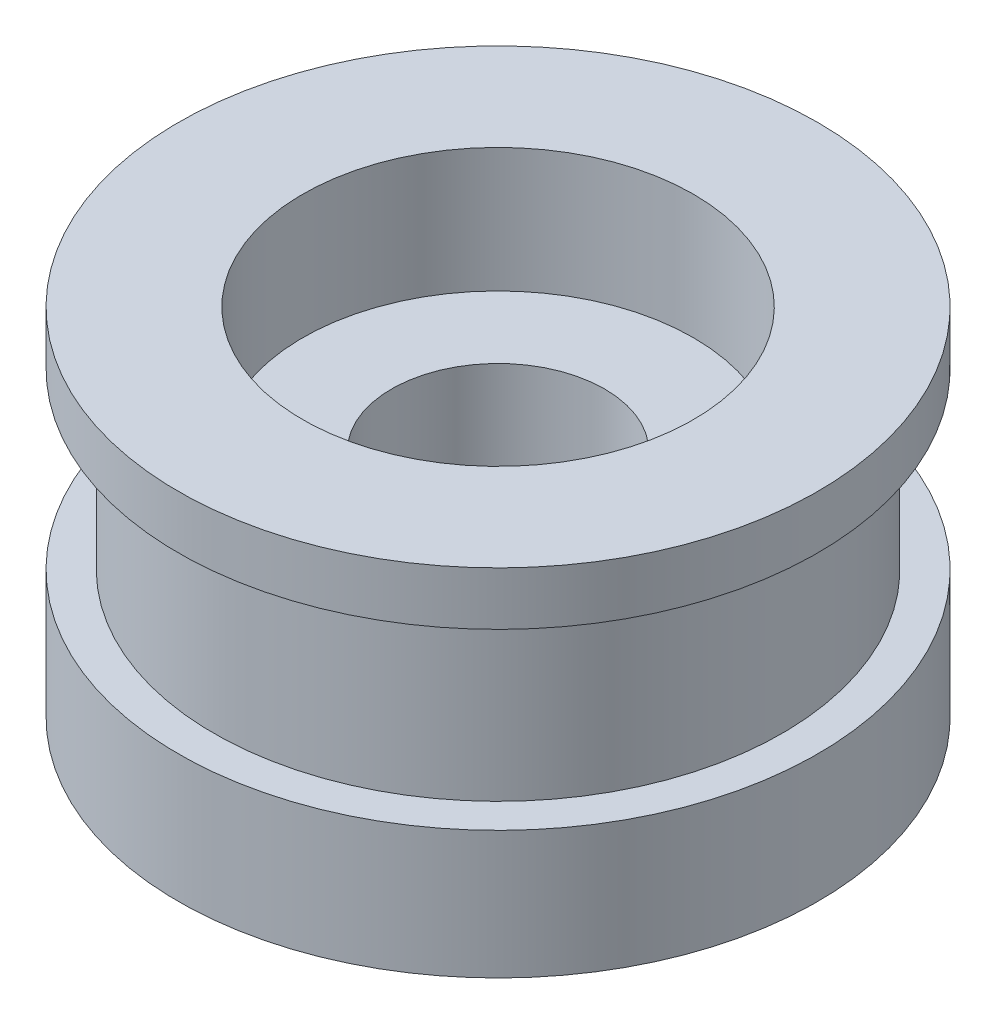
from build123d import *


with BuildPart() as part:
    # Sketch1 → Revolve1 (revolve)
    with BuildSketch(Plane.XY, mode=Mode.PRIVATE) as revolve1_sk:
        Polygon((1.5, 0), (1.5, 3.25), (2.75, 3.25), (2.75, 5), (4.5, 5), (4.5, 4.25), (4, 4.25), (4, 1.8), (4.5, 1.8), (4.5, 0), align=None)
    revolve(revolve1_sk.sketch.rotate(Axis((0, -50, 0), (0, 1, 0)), 90), axis=Axis((0, -50, 0), (0, 1, 0)))


solid = part.part
